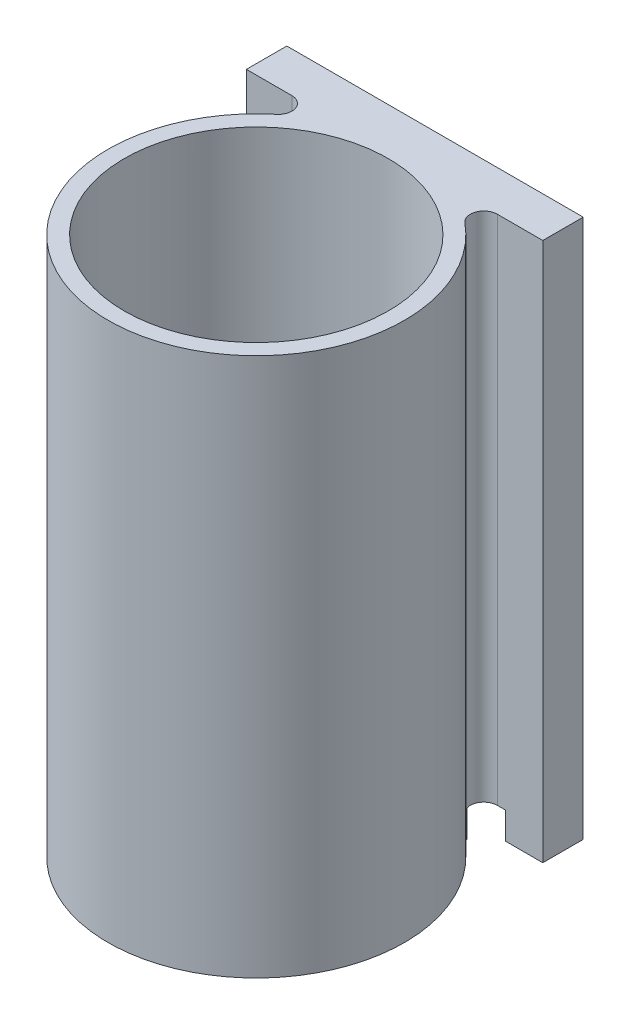
from build123d import *

# Parameters (mm, degrees)
SKETCH_1_W          = 22
SKETCH_1_H          = 40
EXTRUDE_1_DEPTH     = 3
SKETCH_2_R          = 11
SKETCH_2_R_2        = 9.8
EXTRUDE_2_DEPTH     = 40
FILLET_1_R          = 1
SKETCH_3_W          = 16.462875958
SKETCH_3_H          = 8.59071229
CUT_EXTRUDE_1_DEPTH = 2


with BuildPart() as part:
    # Эскиз1 → Бобышка-Вытянуть1 (new body)
    with BuildSketch(Plane.XY):
        Rectangle(SKETCH_1_W, SKETCH_1_H)
    extrude(amount=EXTRUDE_1_DEPTH)

    # Эскиз2 → Бобышка-Вытянуть2 (add)
    with BuildSketch(Plane(origin=(0, 20, 0), x_dir=(1, 0, 0), z_dir=(0, 1, 0))):
        with Locations((0, -13.26772589)):
            Circle(SKETCH_2_R)
        with Locations(Location((0, -13.26772589, 0), (0, 0, 270))):
            Circle(SKETCH_2_R_2, mode=Mode.SUBTRACT)
    extrude(amount=-EXTRUDE_2_DEPTH)

    # Скругление1
    fillet_1_edges = [part.edges().sort_by_distance(p)[0] for p in [
        (-3.946366055, 0, 3),
        (3.946366055, 0, 3),
    ]]
    fillet(fillet_1_edges, radius=FILLET_1_R)

    # Эскиз3 → Вырез-Вытянуть1 (cut)
    with BuildSketch(Plane.XZ.offset(20)):
        Rectangle(SKETCH_3_W, SKETCH_3_H)
    extrude(amount=-CUT_EXTRUDE_1_DEPTH, mode=Mode.SUBTRACT)


solid = part.part
